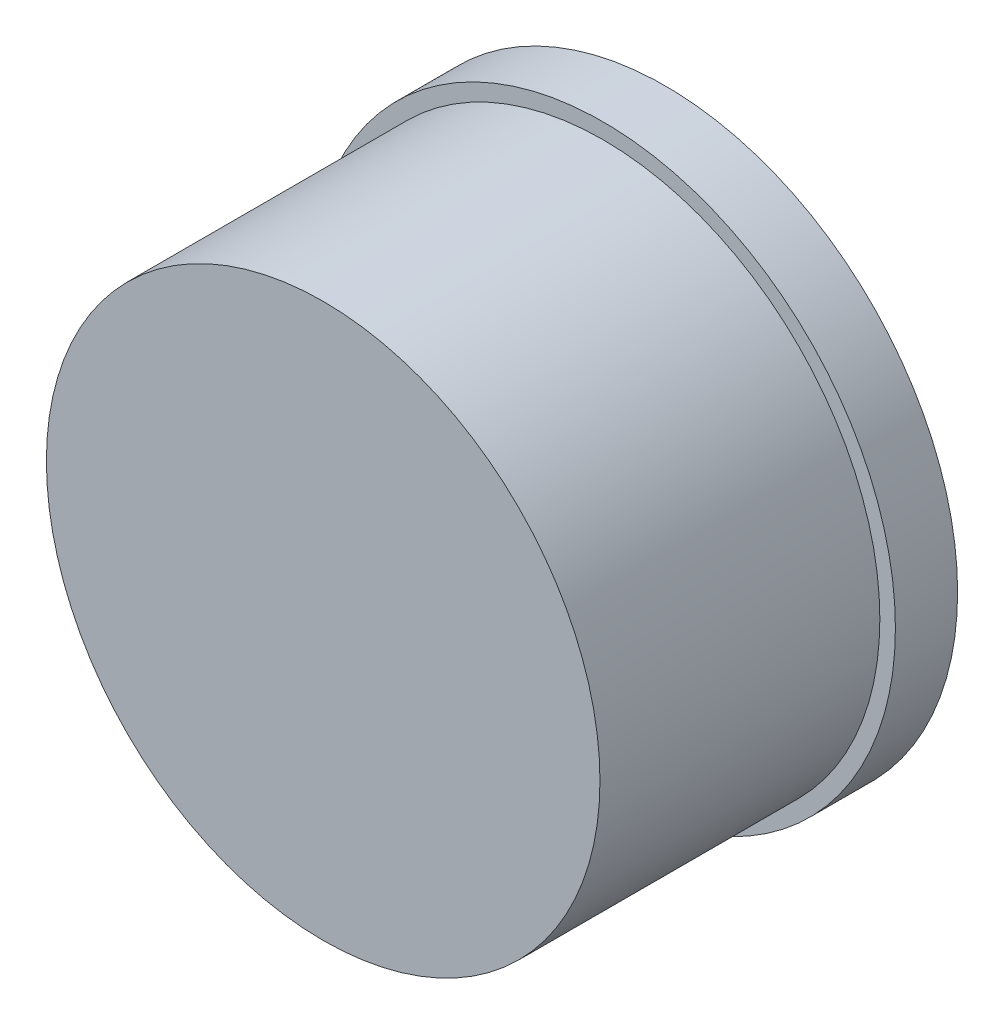
from build123d import *

# Parameters (mm, degrees)
SKETCH1_R           = 4.7
BOSS_EXTRUDE1_DEPTH = 1
SKETCH2_R           = 4.45
BOSS_EXTRUDE2_DEPTH = 4.5


with BuildPart() as part:
    # Sketch1 → Boss-Extrude1 (new body)
    with BuildSketch(Plane.XY):
        with Locations((-36.076935723, 25.788328128)):
            Circle(SKETCH1_R)
    extrude(amount=BOSS_EXTRUDE1_DEPTH)

    # Sketch2 → Boss-Extrude2 (add)
    with BuildSketch(Plane.XY.offset(1)):
        with Locations((-36.076935723, 25.788328128)):
            Circle(SKETCH2_R)
    extrude(amount=BOSS_EXTRUDE2_DEPTH)


solid = part.part
